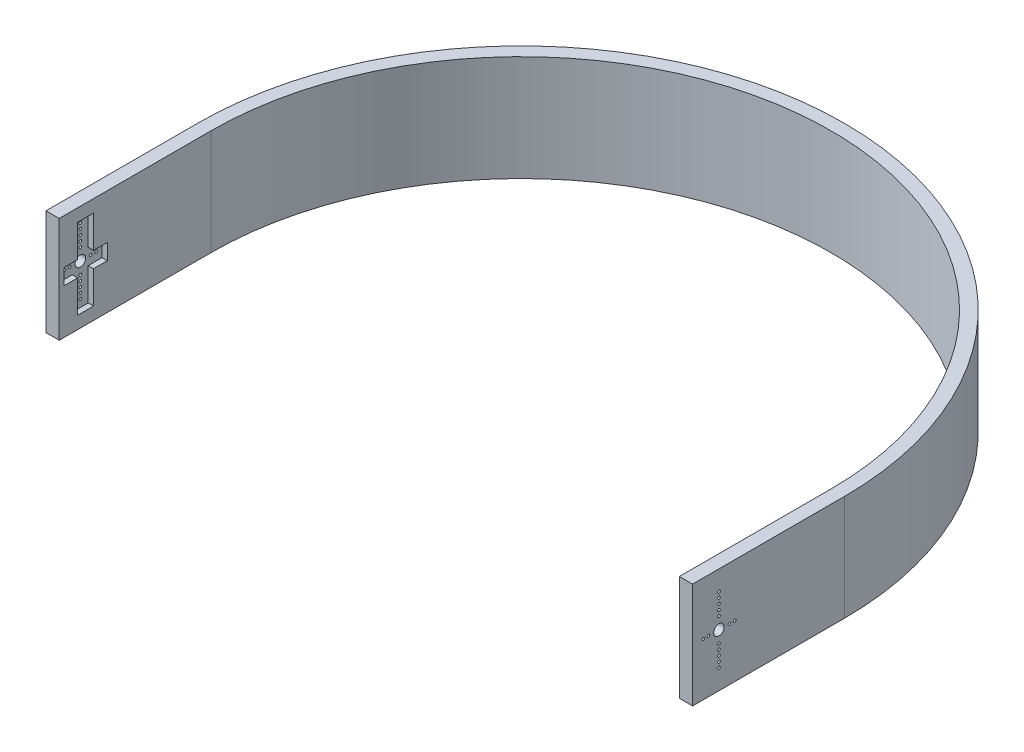
from build123d import *

# Parameters (mm, degrees)
BOSS_EXTRUDE1_DEPTH = 20
SKETCH2_R           = 2
SKETCH2_R_2         = 0.5
CUT_EXTRUDE1_DEPTH  = 299.872882678
CUT_EXTRUDE2_START  = -2
CUT_EXTRUDE2_DEPTH  = 239


with BuildPart() as part:
    # Sketch1 → Boss-Extrude1 (new, symmetric)
    with BuildSketch(Plane(origin=(0, 0, 0), x_dir=(1, 0, 0), z_dir=(0, 1, 0))):
        with BuildLine():
            Line((-117.5, -10), (-117.5, 10))
            Line((-117.5, 10), (-117.5, 47.5))
            ThreePointArc((-117.5, 47.5), (0, 165), (117.5, 47.5))
            Line((117.5, 47.5), (117.5, 10))
            Line((117.5, 10), (117.5, -10))
            Line((117.5, -10), (122.5, -10))
            Line((122.5, -10), (122.5, 47.5))
            ThreePointArc((122.5, 47.5), (0, 170), (-122.5, 47.5))
            Line((-122.5, 47.5), (-122.5, -10))
            Line((-122.5, -10), (-117.5, -10))
        make_face()
    extrude(amount=BOSS_EXTRUDE1_DEPTH, both=True)

    # Sketch2 → Cut-Extrude1 (cut, through all)
    with BuildSketch(Plane.ZY.offset(122.5)):
        Circle(SKETCH2_R)
        with Locations((4, 0)):
            Circle(SKETCH2_R_2)
        with Locations((6, 0)):
            Circle(SKETCH2_R_2)
        with Locations((-6, 0)):
            Circle(SKETCH2_R_2)
        with Locations((-4, 0)):
            Circle(SKETCH2_R_2)
        with Locations((0, 4.5)):
            Circle(SKETCH2_R_2)
        with Locations((0, 6.5)):
            Circle(SKETCH2_R_2)
        with Locations((0, 8.5)):
            Circle(SKETCH2_R_2)
        with Locations((0, 10.5)):
            Circle(SKETCH2_R_2)
        with Locations((0, 12.5)):
            Circle(SKETCH2_R_2)
        with Locations((0, -12.5)):
            Circle(SKETCH2_R_2)
        with Locations((0, -10.5)):
            Circle(SKETCH2_R_2)
        with Locations((0, -8.5)):
            Circle(SKETCH2_R_2)
        with Locations((0, -6.5)):
            Circle(SKETCH2_R_2)
        with Locations((0, -4.5)):
            Circle(SKETCH2_R_2)
    extrude(amount=-CUT_EXTRUDE1_DEPTH, mode=Mode.SUBTRACT)

    # Sketch3 → Cut-Extrude2 (cut)
    with BuildSketch(Plane(origin=(-117.5, 0, 0), x_dir=(0, 0, -1), z_dir=(1, 0, 0)).offset(CUT_EXTRUDE2_START)):
        Polygon((-8.25, 3), (-8.25, -3), (-3, -3), (-3, -15.25), (3, -15.25), (3, -3), (8.25, -3), (8.25, 3), (3, 3), (3, 15.25), (-3, 15.25), (-3, 3), align=None)
    extrude(amount=CUT_EXTRUDE2_DEPTH, mode=Mode.SUBTRACT)


solid = part.part
